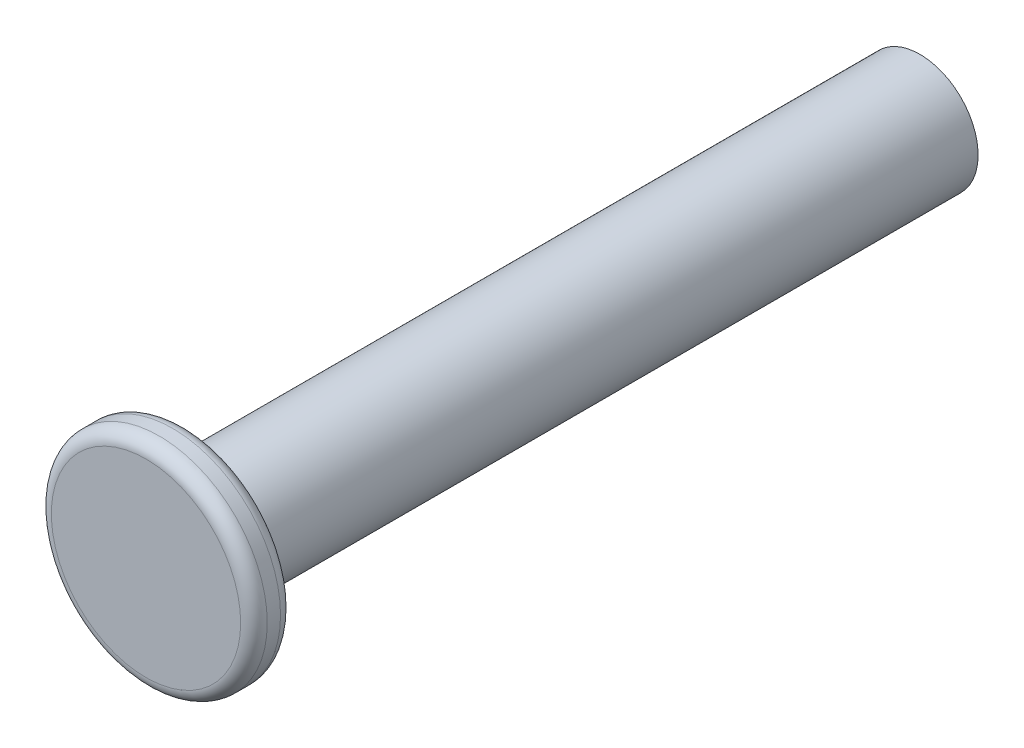
from build123d import *

# Parameters (mm, degrees)
CROQUIS1_R              = 3.25
SALIENTE_EXTRUIR1_DEPTH = 1.2
CROQUIS2_R              = 1.75
SALIENTE_EXTRUIR2_DEPTH = 22.1
REDONDEO2_R             = 0.4


with BuildPart() as part:
    # Croquis1 → Saliente-Extruir1 (new body)
    with BuildSketch(Plane.XY):
        Circle(CROQUIS1_R)
    extrude(amount=SALIENTE_EXTRUIR1_DEPTH)

    # Croquis2 → Saliente-Extruir2 (add)
    with BuildSketch(Plane(origin=(0, 0, 0), x_dir=(-1, 0, 0), z_dir=(0, 0, -1))):
        Circle(CROQUIS2_R)
    extrude(amount=SALIENTE_EXTRUIR2_DEPTH)

    # Redondeo2
    redondeo2_edges = [part.edges().sort_by_distance(p)[0] for p in [
        (-3.25, 0, 0),
        (-3.25, 0, 1.2),
    ]]
    fillet(redondeo2_edges, radius=REDONDEO2_R)


solid = part.part
